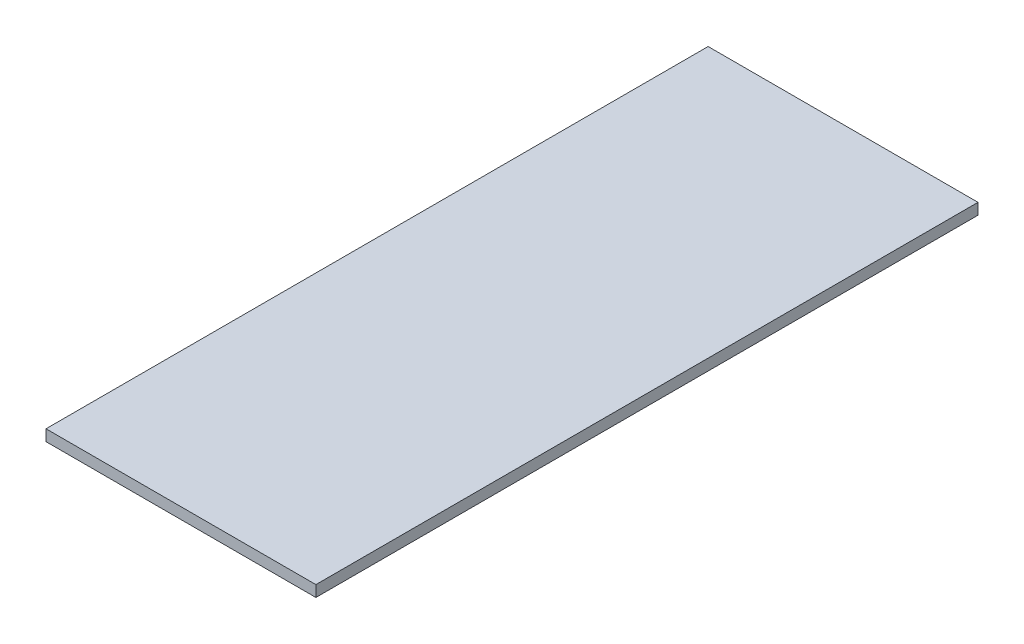
from build123d import *

# Parameters (mm, degrees)
SKETCH1_W           = 61.346886038
SKETCH1_H           = 150.502113272
BOSS_EXTRUDE1_DEPTH = 2.54


with BuildPart() as part:
    # Sketch1 → Boss-Extrude1 (new body)
    with BuildSketch(Plane(origin=(0, 0, 0), x_dir=(1, 0, 0), z_dir=(0, 1, 0))):
        Rectangle(SKETCH1_W, SKETCH1_H)
    extrude(amount=BOSS_EXTRUDE1_DEPTH)


solid = part.part
